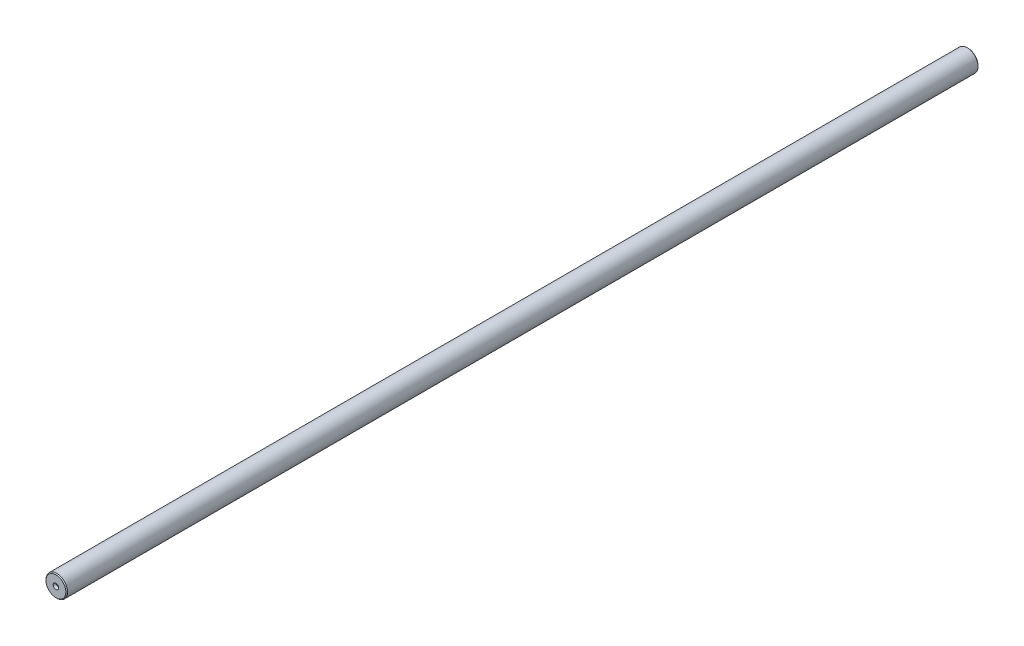
from build123d import *

# Parameters (mm, degrees)
SKETCH1_R           = 12.5
CORPO_25_1056_DEPTH = 528
CHANFRO_1_45_SIZE   = 1


with BuildPart() as part:
    # Sketch1 → Corpo Ø25×1056 (new, symmetric)
    with BuildSketch(Plane.XY):
        Circle(SKETCH1_R)
    extrude(amount=CORPO_25_1056_DEPTH, both=True)

    # Sketch4 → Furo de Centro (revolve, cut)
    with BuildSketch(Plane(origin=(0, 0, -528), x_dir=(0, 1, 0), z_dir=(1, 0, 0))):
        Polygon((0, 0), (0, 10), (1.7, 8.978536948), (1.7, 2.511473671), (3.15, 0), align=None)
    furo_de_centro = revolve(axis=Axis((0, 0, -534.35), (0, 0, 1)), mode=Mode.SUBTRACT)

    # Furo de Centro Espelhado: Furo de Centro across plane
    add(furo_de_centro.mirror(Plane.XY), mode=Mode.SUBTRACT)

    # Chanfro 1×45°
    chanfro_1_45_edges = [part.edges().sort_by_distance(p)[0] for p in [
        (-12.5, 0, -528),
        (-12.5, 0, 528),
    ]]
    chamfer(chanfro_1_45_edges, length=CHANFRO_1_45_SIZE)


solid = part.part
